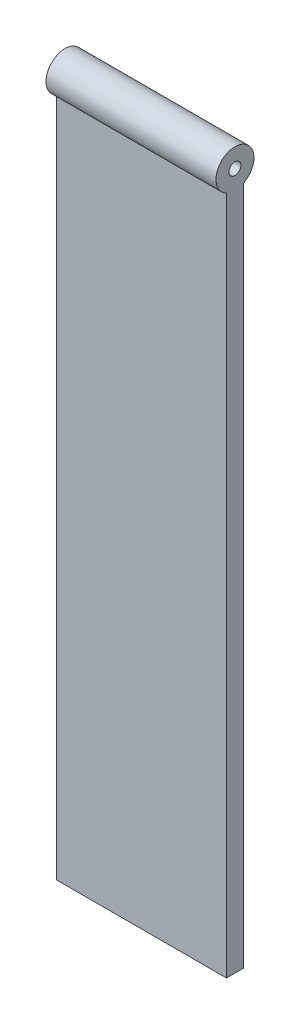
from build123d import *

# Parameters (mm, degrees)
SKETCH2_R           = 0.7
BOSS_EXTRUDE1_DEPTH = 20


with BuildPart() as part:
    # Sketch2 → Boss-Extrude1 (new body)
    with BuildSketch(Plane(origin=(0, 0, 0), x_dir=(0, 0, -1), z_dir=(1, 0, 0))):
        with BuildLine():
            Line((0, 0), (2, 0))
            Line((2, 0), (2, 80))
            ThreePointArc((2, 80), (1, 84.236067977), (0, 80))
            Line((0, 80), (0, 0))
        make_face()
        with Locations((1, 82)):
            Circle(SKETCH2_R, mode=Mode.SUBTRACT)
    extrude(amount=BOSS_EXTRUDE1_DEPTH)


solid = part.part
